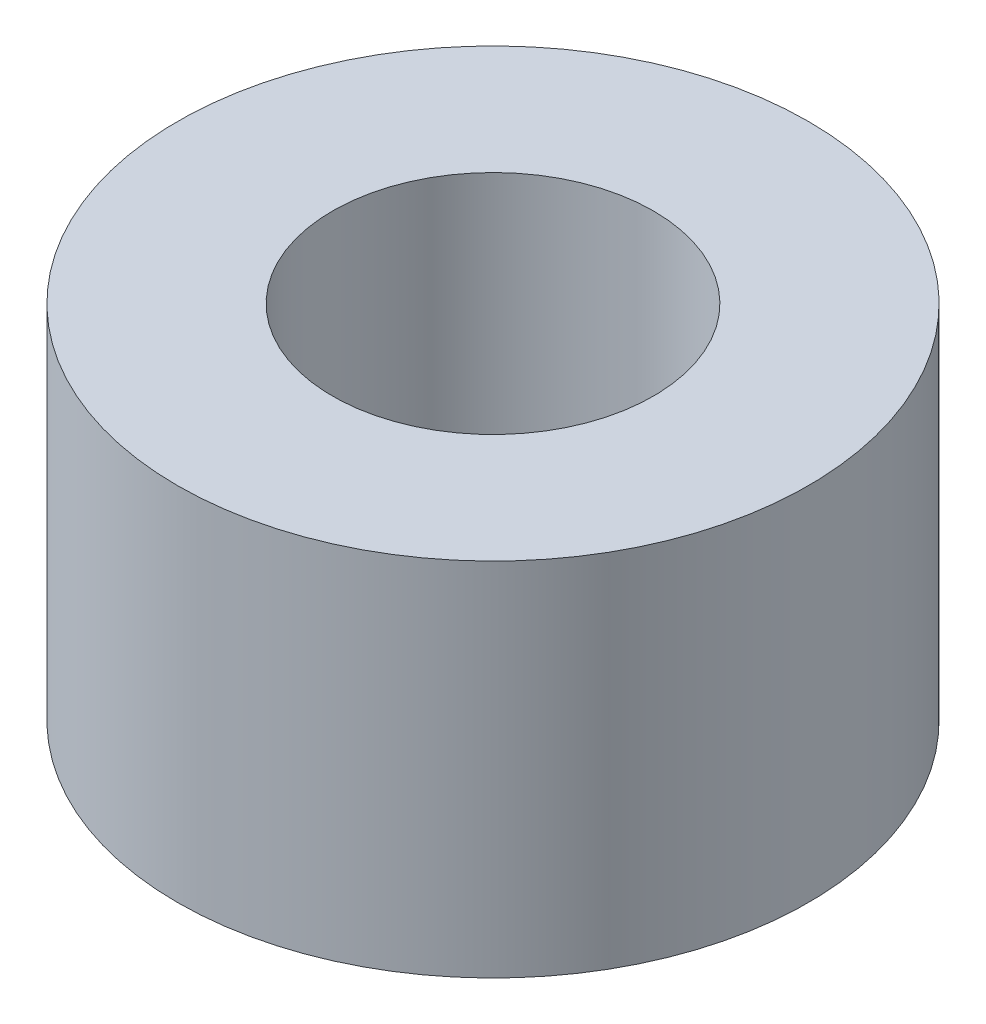
from build123d import *

# Parameters (mm, degrees)
ESQUISSE1_R        = 6.24205
ESQUISSE1_R_2      = 3.175
BOSS_EXTRU_1_DEPTH = 7.14502


with BuildPart() as part:
    # Esquisse1 → Boss.-Extru.1 (new body)
    with BuildSketch(Plane(origin=(0, 0, 0), x_dir=(1, 0, 0), z_dir=(0, 1, 0))):
        with Locations(Location((0, 0, 0), (0, 0, 90))):
            Circle(ESQUISSE1_R)
        with Locations(Location((0, 0, 0), (0, 0, 90))):
            Circle(ESQUISSE1_R_2, mode=Mode.SUBTRACT)
    extrude(amount=BOSS_EXTRU_1_DEPTH)


solid = part.part
